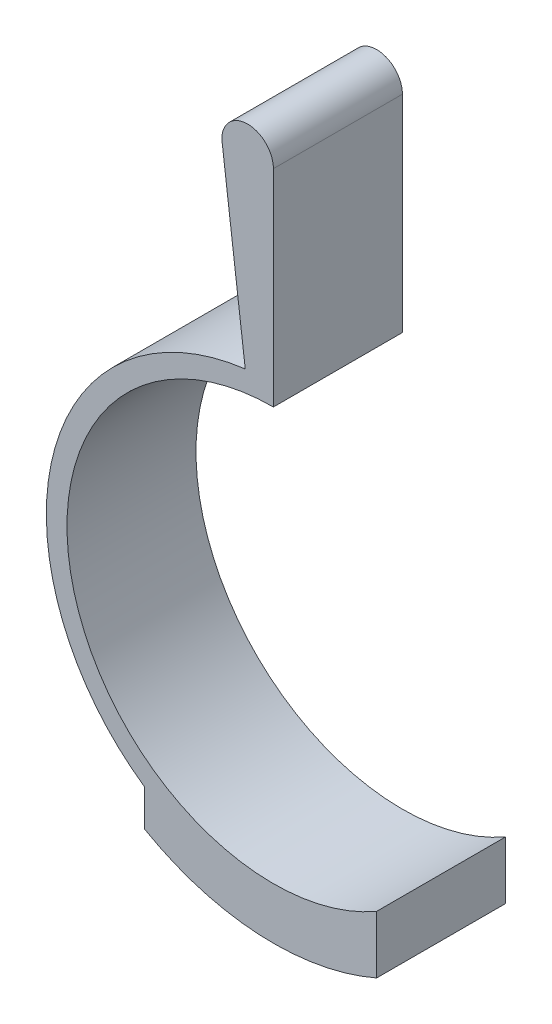
from build123d import *

# Parameters (mm, degrees)
RESSALTO_EXTRUS_O1_DEPTH = 12.5


with BuildPart() as part:
    # Esboço1 → Ressalto-extrusão1 (new body)
    with BuildSketch(Plane.XY):
        with BuildLine():
            Line((10, -22.912878475), (10, -17.320508076))
            ThreePointArc((10, -17.320508076), (-19.318516526, -5.176380902), (0, 20))
            Line((0, 20), (0, 40))
            ThreePointArc((0, 40), (-2.5, 42.5), (-5, 40))
            Line((-5, 40), (-4.923076923, 39.384615385))
            Line((-4.923076923, 39.384615385), (-2.728764161, 21.830113288))
            ThreePointArc((-2.728764161, 21.830113288), (-21.36959311, 5.228813472), (-12.5, -18.10386699))
            Line((-12.5, -18.10386699), (-12.5, -21.650635095))
            ThreePointArc((-12.5, -21.650635095), (-1.400290894, -24.960752902), (10, -22.912878475))
        make_face()
    extrude(amount=RESSALTO_EXTRUS_O1_DEPTH)


solid = part.part
